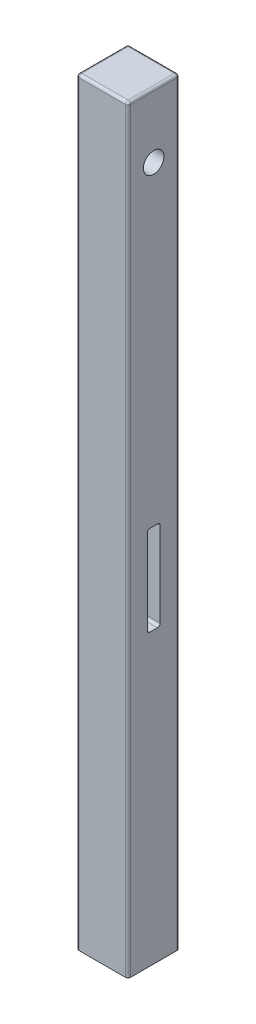
from build123d import *

# Parameters (mm, degrees)
SKETCH1_W                       = 20
SKETCH1_H                       = 295.2
BOSS_EXTRUDE1_DEPTH             = 20
CUT_EXTRUDE1_REACH              = 298.552
SKETCH2_R                       = 4
CUT_EXTRUDE2_DEPTH              = 14.1
CUT_EXTRUDE3_DEPTH              = 297.551917883
M3X0_5_TAPPED_HOLE1_D           = 2.5
M3X0_5_TAPPED_HOLE1_DEPTH       = 18
M3X0_5_TAPPED_HOLE1_CSINK_D     = 5.6
M3X0_5_TAPPED_HOLE1_CSINK_ANGLE = 90
M3X0_5_TAPPED_HOLE1_TIP         = 0.751075774
FILLET1_R                       = 1
FILLET2_R                       = 1


with BuildPart() as part:
    # Sketch1 → Boss-Extrude1 (new body)
    with BuildSketch(Plane.XY):
        with Locations((0, 147.6)):
            Rectangle(SKETCH1_W, SKETCH1_H)
    extrude(amount=BOSS_EXTRUDE1_DEPTH)

    # Sketch2 → Cut-Extrude1 (cut, up to next)
    with BuildSketch(Plane(origin=(10, 0, 0), x_dir=(0, 0, -1), z_dir=(1, 0, 0)), mode=Mode.PRIVATE) as cut_extrude1_sk1:
        with Locations(Location((-10, 270.2, 0), (0, 0, 90))):
            Circle(SKETCH2_R)
    cut_extrude1_tool1 = extrude(cut_extrude1_sk1.sketch, amount=-CUT_EXTRUDE1_REACH, mode=Mode.PRIVATE) & part.part
    add(cut_extrude1_tool1.solids().sort_by_distance((10, 270.2, 10))[0], mode=Mode.SUBTRACT)

    # Sketch3 → Cut-Extrude2 (cut)
    with BuildSketch(Plane.XZ):
        with BuildLine():
            Line((-5.25, 2.5), (5.25, 2.5))
            ThreePointArc((5.25, 2.5), (5.957106781, 2.792893219), (6.25, 3.5))
            Line((6.25, 3.5), (6.25, 16.5))
            ThreePointArc((6.25, 16.5), (5.957106781, 17.207106781), (5.25, 17.5))
            Line((5.25, 17.5), (-5.25, 17.5))
            ThreePointArc((-5.25, 17.5), (-5.957106781, 17.207106781), (-6.25, 16.5))
            Line((-6.25, 16.5), (-6.25, 3.5))
            ThreePointArc((-6.25, 3.5), (-5.957106781, 2.792893219), (-5.25, 2.5))
        make_face()
        with BuildLine():
            Line((-4, 7.5), (4, 7.5))
            ThreePointArc((4, 7.5), (4.707106781, 7.792893219), (5, 8.5))
            Line((5, 8.5), (5, 11.5))
            ThreePointArc((5, 11.5), (4.707106781, 12.207106781), (4, 12.5))
            Line((4, 12.5), (-4, 12.5))
            ThreePointArc((-4, 12.5), (-4.707106781, 12.207106781), (-5, 11.5))
            Line((-5, 11.5), (-5, 8.5))
            ThreePointArc((-5, 8.5), (-4.707106781, 7.792893219), (-4, 7.5))
        make_face(mode=Mode.SUBTRACT)
    extrude(amount=-CUT_EXTRUDE2_DEPTH, mode=Mode.SUBTRACT)

    # Sketch5 → Cut-Extrude3 (cut, through all)
    with BuildSketch(Plane.ZY.offset(10)):
        with BuildLine():
            Line((8.5, 147.6), (11.5, 147.6))
            ThreePointArc((11.5, 147.6), (12.207106781, 147.307106781), (12.5, 146.6))
            Line((12.5, 146.6), (12.5, 113.6))
            ThreePointArc((12.5, 113.6), (12.207106781, 112.892893219), (11.5, 112.6))
            Line((11.5, 112.6), (8.5, 112.6))
            ThreePointArc((8.5, 112.6), (7.792893219, 112.892893219), (7.5, 113.6))
            Line((7.5, 113.6), (7.5, 146.6))
            ThreePointArc((7.5, 146.6), (7.792893219, 147.307106781), (8.5, 147.6))
        make_face()
    extrude(amount=-CUT_EXTRUDE3_DEPTH, mode=Mode.SUBTRACT)

    # M3x0.5 Tapped Hole1
    with Locations(Plane.ZY.offset(10)):
        with Locations((15, 7.05), (5, 7.05)):
            CounterSinkHole(M3X0_5_TAPPED_HOLE1_D / 2, M3X0_5_TAPPED_HOLE1_CSINK_D / 2, depth=M3X0_5_TAPPED_HOLE1_DEPTH, counter_sink_angle=M3X0_5_TAPPED_HOLE1_CSINK_ANGLE)
            with Locations((0, 0, -(M3X0_5_TAPPED_HOLE1_DEPTH + M3X0_5_TAPPED_HOLE1_TIP / 2))):  # 118° drill point
                Cone(0, M3X0_5_TAPPED_HOLE1_D / 2, M3X0_5_TAPPED_HOLE1_TIP, mode=Mode.SUBTRACT)

    # Fillet1
    fillet1_edges = [part.edges().sort_by_distance(p)[0] for p in [
        (-10, 295.2, 10),
        (10, 295.2, 10),
    ]]
    fillet(fillet1_edges, radius=FILLET1_R)

    # Fillet2
    fillet2_edges = [part.edges().sort_by_distance(p)[0] for p in [
        (10, 147.1, 20),
        (0, 295.2, 0),
        (0, 295.2, 20),
        (-10, 147.1, 0),
        (-9.707106781, 294.907106781, 0),
        (9.707106781, 294.907106781, 0),
        (-10, 147.1, 20),
        (-9.707106781, 294.907106781, 20),
        (9.707106781, 294.907106781, 20),
        (10, 147.1, 0),
    ]]
    fillet(fillet2_edges, radius=FILLET2_R)


solid = part.part
